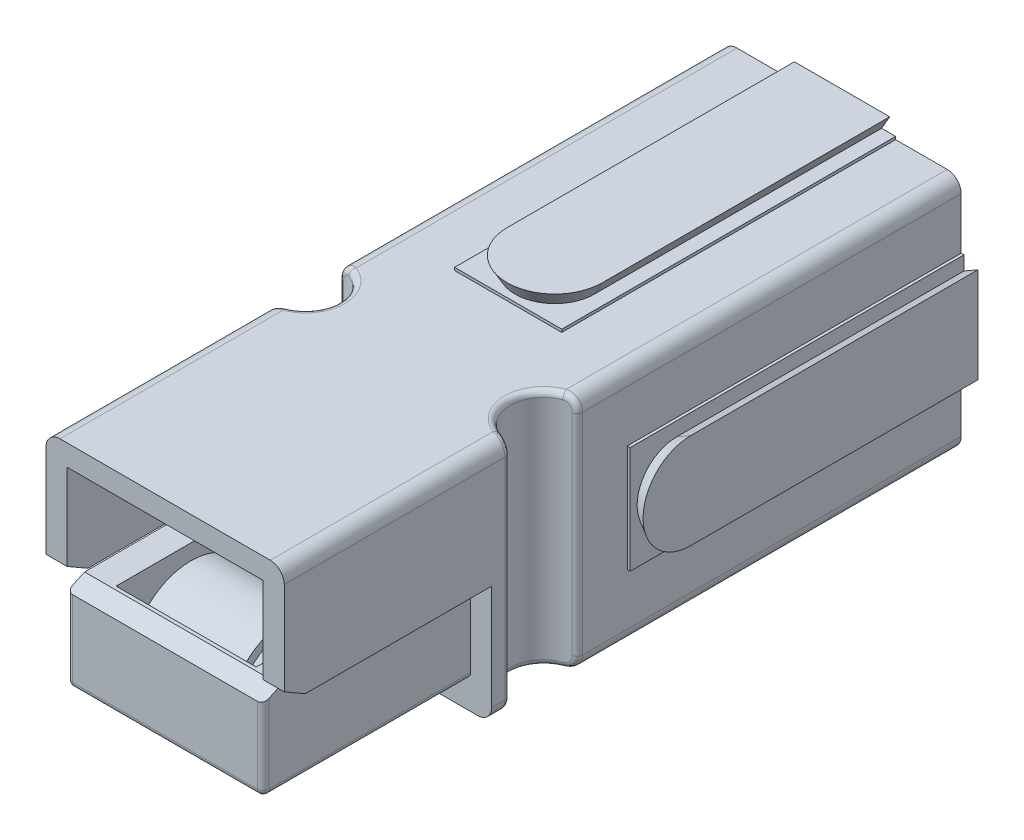
from build123d import *

# Parameters (mm, degrees)
ESQUISSE1_W              = 8.5
ESQUISSE1_H              = 8.5
EXTRUSION1_DEPTH         = 24.15
ENL_V_MAT_EXTRU_5_DEPTH  = 7.4
SKETCH2_W                = 7
SKETCH2_H                = 3.55
CUT_EXTRUDE12_DEPTH      = 8
ESQUISSE8_W              = 5.7
ESQUISSE8_H              = 5.7
ENL_V_MAT_EXTRU_7_DEPTH  = 10
CUT_EXTRUDE7_DEPTH       = 10.25
CUT_REVOLVE1_ANGLE       = 180
BOSS_EXTRUDE5_DEPTH      = 0.1
CUT_REVOLVE2_ANGLE       = 180
BOSS_EXTRUDE6_DEPTH      = 0.1
SKETCH16_W               = 3.82264973
SKETCH16_H               = 11.911324865
BOSS_EXTRUDE7_DEPTH      = 0.1
SKETCH17_W               = 11.911324865
SKETCH17_H               = 3.82264973
BOSS_EXTRUDE8_DEPTH      = 0.1
BOSS_EXTRUDE4_DEPTH      = 10.25
REVOLVE1_ANGLE           = 180
REVOLVE2_ANGLE           = 180
SKETCH13_W               = 5
SKETCH13_H               = 6.65
CUT_EXTRUDE16_DEPTH      = 2.5
EXTRUSION2_DEPTH         = 1.75
EXTRUSION2_DEPTH_BACK    = 1.75
SKETCH9_R                = 2
CUT_EXTRUDE9_DEPTH       = 6.75
CUT_EXTRUDE10_DEPTH      = 8.6
FILLET1_R                = 0.5
FILLET2_R                = 0.2
CUT_EXTRUDE11_DEPTH      = 4.5
CUT_EXTRUDE11_DEPTH_BACK = 4.5
SCALE3_SCALE             = 0.88624


with BuildPart() as part:
    # Esquisse1 → Extrusion1 (new body)
    with BuildSketch(Plane.XY):
        Rectangle(ESQUISSE1_W, ESQUISSE1_H)
    extrude(amount=EXTRUSION1_DEPTH)

    # Esquisse5 → Enlèv. mat.-Extru.5 (cut)
    with BuildSketch(Plane.XY.offset(24.15)):
        Polygon((-4.25, 0), (-4.25, -4.25), (4.25, -4.25), (4.25, 0), (3.5, 0), (3.5, -3.25), (0, -3.25), (-3.5, -3.25), (-3.5, 0), align=None)
    extrude(amount=-ENL_V_MAT_EXTRU_5_DEPTH, mode=Mode.SUBTRACT)

    # Sketch2 → Cut-Extrude12 (cut)
    with BuildSketch(Plane.XY.offset(16.75)):
        with Locations((0, 1.725)):
            Rectangle(SKETCH2_W, SKETCH2_H)
    extrude(amount=CUT_EXTRUDE12_DEPTH, mode=Mode.SUBTRACT)

    # Esquisse8 → Enlèv. mat.-Extru.7 (cut)
    with BuildSketch(Plane(origin=(0, 0, 0), x_dir=(-1, 0, 0), z_dir=(0, 0, -1))):
        Rectangle(ESQUISSE8_W, ESQUISSE8_H)
    extrude(amount=-ENL_V_MAT_EXTRU_7_DEPTH, mode=Mode.SUBTRACT)

    # Esquisse12 → Cut-Extrude7 (cut)
    with BuildSketch(Plane(origin=(0, 0, 0), x_dir=(-1, 0, 0), z_dir=(0, 0, -1))):
        Polygon((3.75, 1.7), (4.25, 1.411324865), (4.25, -1.411324865), (3.75, -1.7), align=None)
        Polygon((-1.411324865, -4.25), (1.411324865, -4.25), (1.7, -3.75), (-1.7, -3.75), align=None)
    extrude(amount=-CUT_EXTRUDE7_DEPTH, mode=Mode.SUBTRACT)

    # Sketch3 → Cut-Revolve1 (revolve, cut)
    with BuildSketch(Plane(origin=(0, 0, 10.25), x_dir=(-1, 0, 0), z_dir=(0, 0, -1))):
        Polygon((3.75, 0), (3.75, -1.7), (4.25, -1.411324865), (4.25, 0), align=None)
    revolve(axis=Axis((-3.75, 0, 10.25), (-1, 0, 0)), revolution_arc=CUT_REVOLVE1_ANGLE, mode=Mode.SUBTRACT)

    # Sketch14 → Boss-Extrude5 (add)
    with BuildSketch(Plane.ZY.offset(4.25)):
        with BuildLine():
            Line((0, 1.411324865), (10.25, 1.411324865))
            ThreePointArc((10.25, 1.411324865), (11.661324865, 0), (10.25, -1.411324865))
            Line((10.25, -1.411324865), (0, -1.411324865))
            Line((0, -1.411324865), (0, -1.911324865))
            Line((0, -1.911324865), (11.911324865, -1.911324865))
            Line((11.911324865, -1.911324865), (11.911324865, 1.911324865))
            Line((11.911324865, 1.911324865), (0, 1.911324865))
            Line((0, 1.911324865), (0, 1.411324865))
        make_face()
    extrude(amount=BOSS_EXTRUDE5_DEPTH)

    # Sketch4 → Cut-Revolve2 (revolve, cut)
    with BuildSketch(Plane(origin=(0, 0, 10.25), x_dir=(-1, 0, 0), z_dir=(0, 0, -1))):
        Polygon((0, -3.75), (1.7, -3.75), (1.411324865, -4.25), (0, -4.25), align=None)
    revolve(axis=Axis((0, -3.75, 10.25), (0, 1, 0)), revolution_arc=CUT_REVOLVE2_ANGLE, mode=Mode.SUBTRACT)

    # Sketch15 → Boss-Extrude6 (add)
    with BuildSketch(Plane.XZ.offset(4.25)):
        with BuildLine():
            Line((-1.411324865, 0), (-1.411324865, 10.25))
            ThreePointArc((-1.411324865, 10.25), (0, 11.661324865), (1.411324865, 10.25))
            Line((1.411324865, 10.25), (1.411324865, 0))
            Line((1.411324865, 0), (1.911324865, 0))
            Line((1.911324865, 0), (1.911324865, 11.911324865))
            Line((1.911324865, 11.911324865), (-1.911324865, 11.911324865))
            Line((-1.911324865, 11.911324865), (-1.911324865, 0))
            Line((-1.911324865, 0), (-1.411324865, 0))
        make_face()
    extrude(amount=BOSS_EXTRUDE6_DEPTH)

    # Sketch16 → Boss-Extrude7 (add)
    with BuildSketch(Plane(origin=(0, 4.25, 0), x_dir=(-1, 0, 0), z_dir=(0, 1, 0))):
        with Locations((0, 5.955662433)):
            Rectangle(SKETCH16_W, SKETCH16_H)
    extrude(amount=BOSS_EXTRUDE7_DEPTH)

    # Sketch17 → Boss-Extrude8 (add)
    with BuildSketch(Plane(origin=(4.25, 0, 0), x_dir=(0, 0, -1), z_dir=(1, 0, 0))):
        with Locations((-5.955662433, 0)):
            Rectangle(SKETCH17_W, SKETCH17_H)
    extrude(amount=BOSS_EXTRUDE8_DEPTH)

    # Sketch5 → Boss-Extrude4 (add)
    with BuildSketch(Plane(origin=(0, 0, 0), x_dir=(-1, 0, 0), z_dir=(0, 0, -1))):
        Polygon((1.411324865, 4.35), (-1.411324865, 4.35), (-1.7, 4.85), (1.7, 4.85), align=None)
        Polygon((-4.85, -1.7), (-4.85, 1.7), (-4.35, 1.411324865), (-4.35, -1.411324865), align=None)
    extrude(amount=-BOSS_EXTRUDE4_DEPTH)

    # Sketch6 → Revolve1 (revolve)
    with BuildSketch(Plane.XY.offset(10.25)):
        Polygon((0, 4.35), (1.411324865, 4.35), (1.7, 4.85), (0, 4.85), align=None)
    revolve(axis=Axis((0, 4.85, 10.25), (0, -1, 0)), revolution_arc=REVOLVE1_ANGLE)

    # Sketch7 → Revolve2 (revolve)
    with BuildSketch(Plane.XY.offset(10.25)):
        Polygon((4.85, -1.7), (4.85, 0), (4.35, 0), (4.35, -1.411324865), align=None)
    revolve(axis=Axis((4.85, 0, 10.25), (-1, 0, 0)), revolution_arc=REVOLVE2_ANGLE)

    # Sketch13 → Cut-Extrude16 (cut)
    with BuildSketch(Plane(origin=(0, -0.05, 0), x_dir=(-1, 0, 0), z_dir=(0, 1, 0))):
        with Locations((0, 20.075)):
            Rectangle(SKETCH13_W, SKETCH13_H)
    extrude(amount=-CUT_EXTRUDE16_DEPTH, mode=Mode.SUBTRACT)

    # Esquisse13 → Extrusion2 (add, two sides: drawn at the far end of the back side and taken through both)
    with BuildSketch(Plane(origin=(0, 0, 0), x_dir=(0, 0, -1), z_dir=(1, 0, 0)).offset(-EXTRUSION2_DEPTH_BACK)):
        with BuildLine():
            Line((-20.021850609, -0.403595516), (-16.75, -1.320909339))
            Line((-16.75, -1.320909339), (-16.75, -1.632477036))
            Line((-16.75, -1.632477036), (-20.171808548, -0.67312019))
            ThreePointArc((-20.171808548, -0.67312019), (-21.988556787, -0.221962307), (-23.305541831, -1.552250996))
            Line((-23.305541831, -1.552250996), (-23.595190502, -1.474125154))
            ThreePointArc((-23.595190502, -1.474125154), (-22.106613177, 0.05614832), (-20.021850609, -0.403595516))
        make_face()
    extrude(amount=EXTRUSION2_DEPTH + EXTRUSION2_DEPTH_BACK)

    # Sketch9 → Cut-Extrude9 (cut)
    with BuildSketch(Plane(origin=(0, 0, 10), x_dir=(-1, 0, 0), z_dir=(0, 0, -1))):
        Circle(SKETCH9_R)
    extrude(amount=-CUT_EXTRUDE9_DEPTH, mode=Mode.SUBTRACT)

    # Sketch10 → Cut-Extrude10 (cut)
    with BuildSketch(Plane(origin=(0, 4.25, 0), x_dir=(-1, 0, 0), z_dir=(0, 1, 0))):
        with BuildLine():
            Line((4.25, 13.693), (4.25, 16.093))
            ThreePointArc((4.25, 16.093), (3.05, 14.893), (4.25, 13.693))
        make_face()
        with BuildLine():
            Line((-4.25, 13.693), (-4.25, 16.093))
            ThreePointArc((-4.25, 16.093), (-3.05, 14.893), (-4.25, 13.693))
        make_face()
    extrude(amount=-CUT_EXTRUDE10_DEPTH, mode=Mode.SUBTRACT)

    # Fillet1
    fillet1_edges = [part.edges().sort_by_distance(p)[0] for p in [
        (-4.25, -4.25, 16.4215),
        (-4.25, -4.25, 6.8465),
        (4.25, -4.25, 6.8465),
        (4.25, -4.25, 16.4215),
        (-4.25, 4.25, 20.1215),
        (-4.25, 4.25, 6.8465),
        (4.25, 4.25, 20.1215),
        (4.25, 4.25, 6.8465),
    ]]
    fillet(fillet1_edges, radius=FILLET1_R)

    # Fillet2
    fillet2_edges = [part.edges().sort_by_distance(p)[0] for p in [
        (-3.5, -3.25, 20.45),
        (3.5, -3.25, 20.45),
        (-3.5, -1.65, 24.15),
        (0, -3.25, 24.15),
        (-3.05, -4.25, 14.893),
        (3.05, -4.25, 14.893),
        (-4.25, 0, 16.093),
        (-3.05, 4.25, 14.893),
        (-4.25, 0, 13.693),
        (-4.098419967, 4.108613337, 13.702612042),
        (-4.098419967, 4.108613337, 16.083387958),
        (-4.098419967, -4.108613337, 13.702612042),
        (-4.098419967, -4.108613337, 16.083387958),
        (4.25, 0, 16.093),
        (4.25, 0, 13.693),
        (3.05, 4.25, 14.893),
        (4.098419968, 4.108613336, 16.083387958),
        (4.098419968, 4.108613336, 13.702612042),
        (4.098419969, -4.108613336, 13.702612042),
        (4.098419969, -4.108613336, 16.083387958),
        (3.5, -1.65, 24.15),
    ]]
    fillet(fillet2_edges, radius=FILLET2_R)

    # Sketch11 → Cut-Extrude11 (cut, two sides: drawn at the far end of the back side and taken through both)
    with BuildSketch(Plane(origin=(0, 0, 0), x_dir=(0, 0, -1), z_dir=(1, 0, 0)).offset(-CUT_EXTRUDE11_DEPTH_BACK)):
        Polygon((-24.15, 0.433012702), (-24.15, 0), (-23.4, 0), align=None)
        Polygon((-24.15, -0.05), (-24.15, -0.338675135), (-23.525, -0.05), align=None)
    extrude(amount=CUT_EXTRUDE11_DEPTH + CUT_EXTRUDE11_DEPTH_BACK, mode=Mode.SUBTRACT)


with BuildPart() as part_1:
    # Scale3: scaled about (0.177051351, 0.25917216, 11.053039564)
    add(part.part.scale(SCALE3_SCALE).moved(Location((0.020141362, 0.029483425, 1.257393781))))


solid = part_1.part
